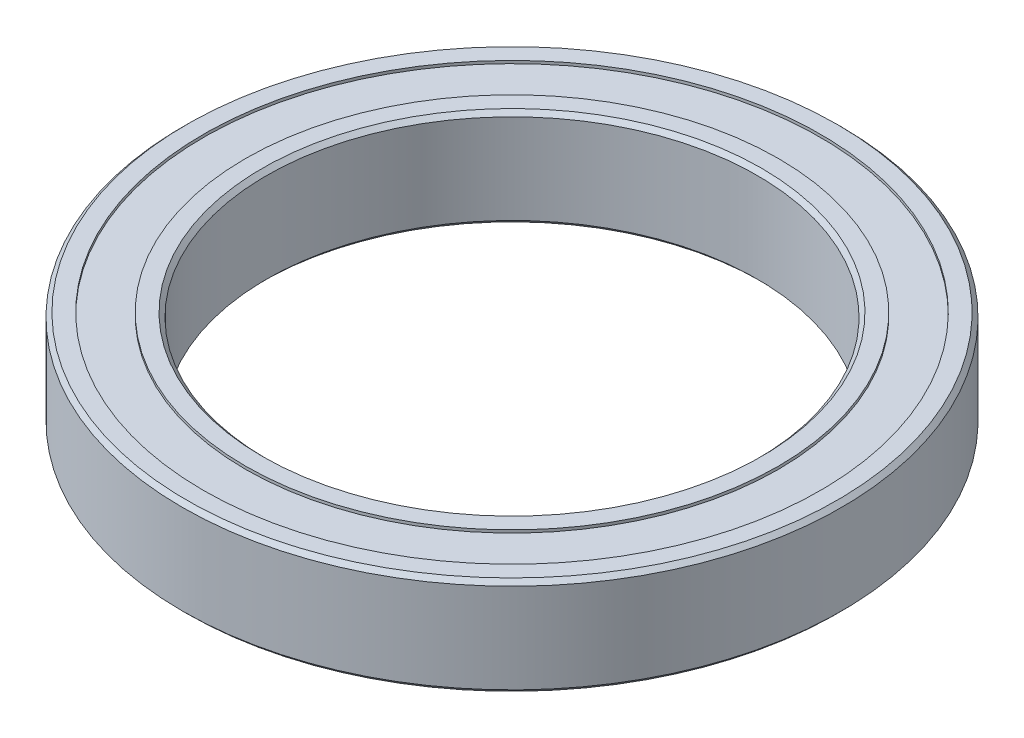
from build123d import *

# Parameters (mm, degrees)
SKETCH1_R           = 23.5
SKETCH1_R_2         = 17.5
BOSS_EXTRUDE1_DEPTH = 7
SKETCH2_R           = 22
SKETCH2_R_2         = 19
CUT_EXTRUDE1_DEPTH  = 0.2
CHAMFER1_SIZE       = 0.3
CUT_EXTRUDE2_START  = -0.2
SKETCH3_R           = 22
SKETCH3_R_2         = 19
CUT_EXTRUDE2_DEPTH  = 0.2


with BuildPart() as part:
    # Sketch1 → Boss-Extrude1 (new body)
    with BuildSketch(Plane(origin=(0, 0, 0), x_dir=(1, 0, 0), z_dir=(0, 1, 0))):
        with Locations(Location((0, 0, 0), (0, 0, 270))):
            Circle(SKETCH1_R)
        with Locations(Location((0, 0, 0), (0, 0, 270))):
            Circle(SKETCH1_R_2, mode=Mode.SUBTRACT)
    extrude(amount=BOSS_EXTRUDE1_DEPTH)

    # Sketch2 → Cut-Extrude1 (cut)
    with BuildSketch(Plane(origin=(0, 7, 0), x_dir=(1, 0, 0), z_dir=(0, 1, 0))):
        with Locations(Location((0, 0, 0), (0, 0, 270))):
            Circle(SKETCH2_R)
        with Locations(Location((0, 0, 0), (0, 0, 270))):
            Circle(SKETCH2_R_2, mode=Mode.SUBTRACT)
    extrude(amount=-CUT_EXTRUDE1_DEPTH, mode=Mode.SUBTRACT)

    # Chamfer1
    chamfer1_edges = [part.edges().sort_by_distance(p)[0] for p in [
        (0, 0, -23.5),
        (0, 7, -23.5),
        (0, 0, -17.5),
        (0, 7, -17.5),
    ]]
    chamfer(chamfer1_edges, length=CHAMFER1_SIZE)

    # Sketch3 → Cut-Extrude2 (cut)
    with BuildSketch(Plane.XZ.offset(CUT_EXTRUDE2_START)):
        with Locations(Location((0, 0, 0), (0, 0, 90))):
            Circle(SKETCH3_R)
        with Locations(Location((0, 0, 0), (0, 0, 90))):
            Circle(SKETCH3_R_2, mode=Mode.SUBTRACT)
    extrude(amount=CUT_EXTRUDE2_DEPTH, mode=Mode.SUBTRACT)


solid = part.part
